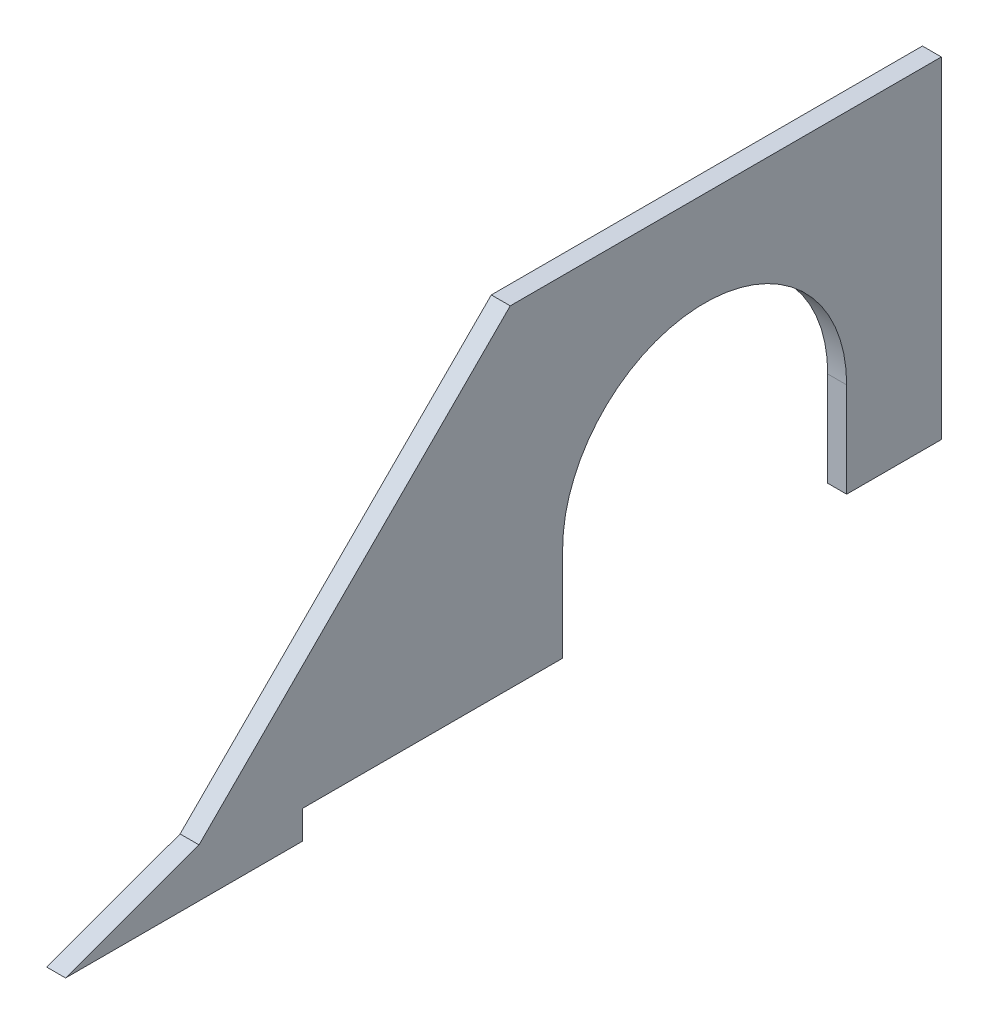
from build123d import *

# Parameters (mm, degrees)
SALIENTE_EXTRUIR2_DEPTH = 4
CORTAR_EXTRUIR1_DEPTH   = 4


with BuildPart() as part:
    # Croquis1 → Saliente-Extruir2 (new body)
    with BuildSketch(Plane(origin=(0, 0, 0), x_dir=(0, 0, -1), z_dir=(1, 0, 0))):
        Polygon((0, 0), (28.190778624, 10.2606043), (93.930174324, 76), (185, 76), (185, 6), (50, 6), (50, 0), align=None)
    extrude(amount=SALIENTE_EXTRUIR2_DEPTH)

    # Croquis2 → Cortar-Extruir1 (cut)
    with BuildSketch(Plane(origin=(4, 0, 0), x_dir=(0, 0, -1), z_dir=(1, 0, 0))):
        with BuildLine():
            Line((105, 6), (165, 6))
            Line((165, 6), (165, 26))
            ThreePointArc((165, 26), (135, 56), (105, 26))
            Line((105, 26), (105, 6))
        make_face()
    extrude(amount=-CORTAR_EXTRUIR1_DEPTH, mode=Mode.SUBTRACT)


solid = part.part
